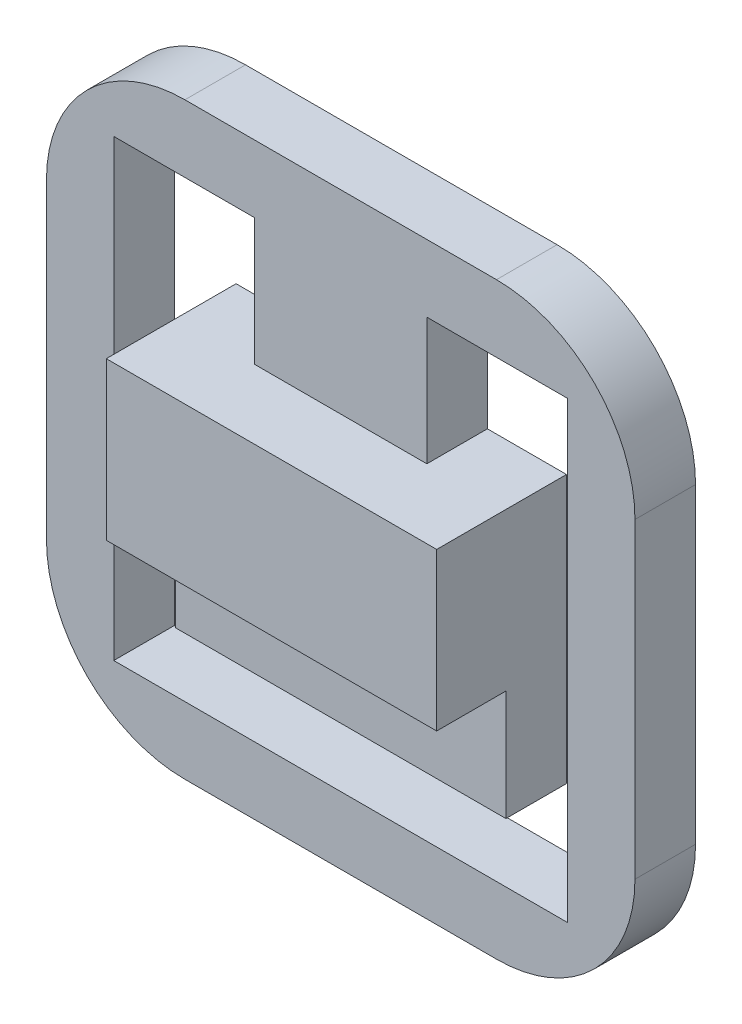
from build123d import *

# Parameters (mm, degrees)
SKETCH2_W           = 34
SKETCH2_H           = 34
SKETCH2_W_2         = 26.224899522
SKETCH2_H_2         = 26.224899522
BOSS_EXTRUDE1_DEPTH = 3.5
SKETCH4_W           = 19.088264776
SKETCH4_H           = 9.085831195
BOSS_EXTRUDE2_DEPTH = 4
FILLET1_R           = 8


with BuildPart() as part:
    # Sketch2 → Boss-Extrude1 (new body)
    # profile 1 of 2: a face of its own
    with BuildSketch(Plane.XY):
        Rectangle(SKETCH2_W, SKETCH2_H)
        Rectangle(SKETCH2_W_2, SKETCH2_H_2, mode=Mode.SUBTRACT)
    # profile 2 of 2: a face of its own
    with BuildSketch(Plane.XY):
        Polygon((4.976248984, 13.112449761), (-4.976248984, 13.112449761), (-4.976248984, 5.775025294), (-9.544132388, 5.775025294), (-9.544132388, -9.69135518), (9.544132388, -9.69135518), (9.544132388, 5.775025294), (4.976248984, 5.775025294), align=None)
    extrude(amount=BOSS_EXTRUDE1_DEPTH)

    # Sketch4 → Boss-Extrude2 (add)
    with BuildSketch(Plane.XY.offset(3.5)):
        with Locations((0, 1.232109697)):
            Rectangle(SKETCH4_W, SKETCH4_H)
    extrude(amount=BOSS_EXTRUDE2_DEPTH)

    # Fillet1
    fillet1_edges = [part.edges().sort_by_distance(p)[0] for p in [
        (-17, 17, 1.75),
        (17, 17, 1.75),
        (17, -17, 1.75),
        (-17, -17, 1.75),
    ]]
    fillet(fillet1_edges, radius=FILLET1_R)


solid = part.part
